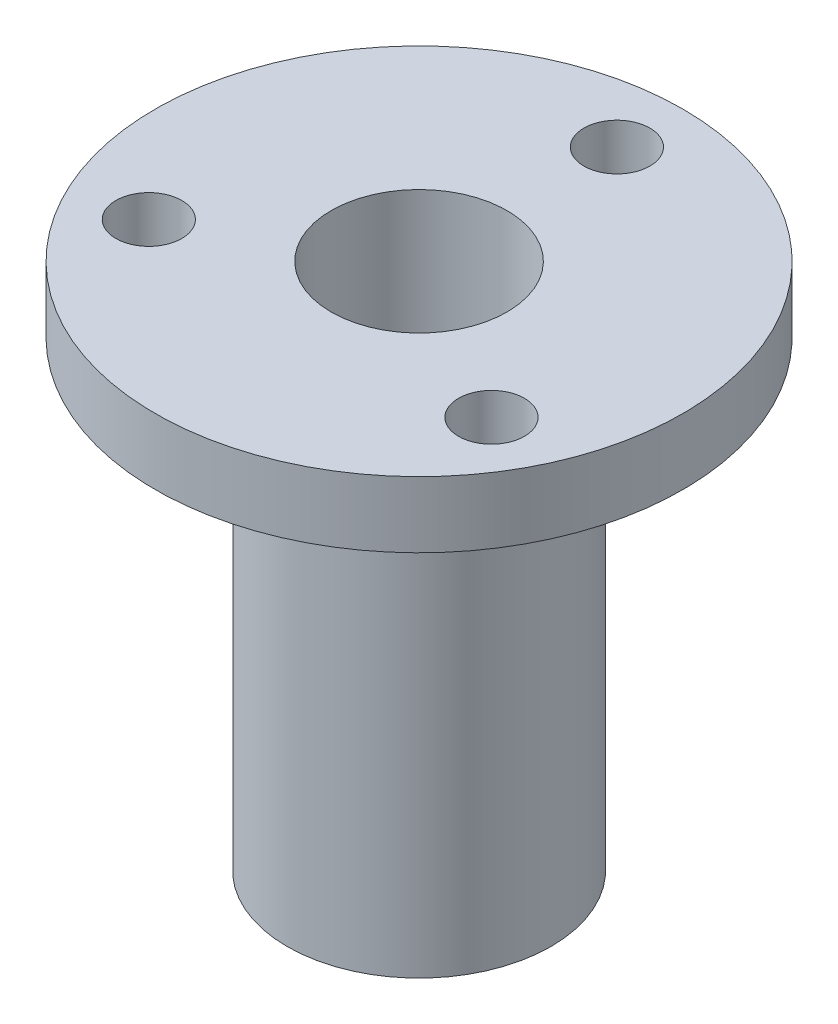
from build123d import *

# Parameters (mm, degrees)
SKETCH1_R           = 19.05
BOSS_EXTRUDE1_DEPTH = 38.1
SKETCH2_R           = 19.05
SKETCH2_R_2         = 9.525
CUT_EXTRUDE1_DEPTH  = 33.3375
SKETCH3_R           = 6.35
SKETCH3_R_2         = 2.38125
CUT_EXTRUDE2_DEPTH  = 38.1


with BuildPart() as part:
    # Sketch1 → Boss-Extrude1 (new body)
    with BuildSketch(Plane(origin=(0, 0, 0), x_dir=(1, 0, 0), z_dir=(0, 1, 0))):
        with Locations(Location((0, 0, 0), (0, 0, 90))):
            Circle(SKETCH1_R)
    extrude(amount=BOSS_EXTRUDE1_DEPTH)

    # Sketch2 → Cut-Extrude1 (cut)
    with BuildSketch(Plane.XZ):
        with Locations(Location((0, 0, 0), (0, 0, 270))):
            Circle(SKETCH2_R)
        with Locations(Location((0, 0, 0), (0, 0, 270))):
            Circle(SKETCH2_R_2, mode=Mode.SUBTRACT)
    extrude(amount=-CUT_EXTRUDE1_DEPTH, mode=Mode.SUBTRACT)

    # Sketch3 → Cut-Extrude2 (cut)
    with BuildSketch(Plane(origin=(0, 38.1, 0), x_dir=(1, 0, 0), z_dir=(0, 1, 0))):
        with Locations(Location((0, 0, 0), (0, 0, 270))):
            Circle(SKETCH3_R)
        with Locations(Location((0, 14.2875, 0), (0, 0, 270))):
            Circle(SKETCH3_R_2)
        with Locations(Location((12.373337957, -7.14375, 0), (0, 0, 270))):
            Circle(SKETCH3_R_2)
        with Locations(Location((-12.373337957, -7.14375, 0), (0, 0, 270))):
            Circle(SKETCH3_R_2)
    extrude(amount=-CUT_EXTRUDE2_DEPTH, mode=Mode.SUBTRACT)


solid = part.part
